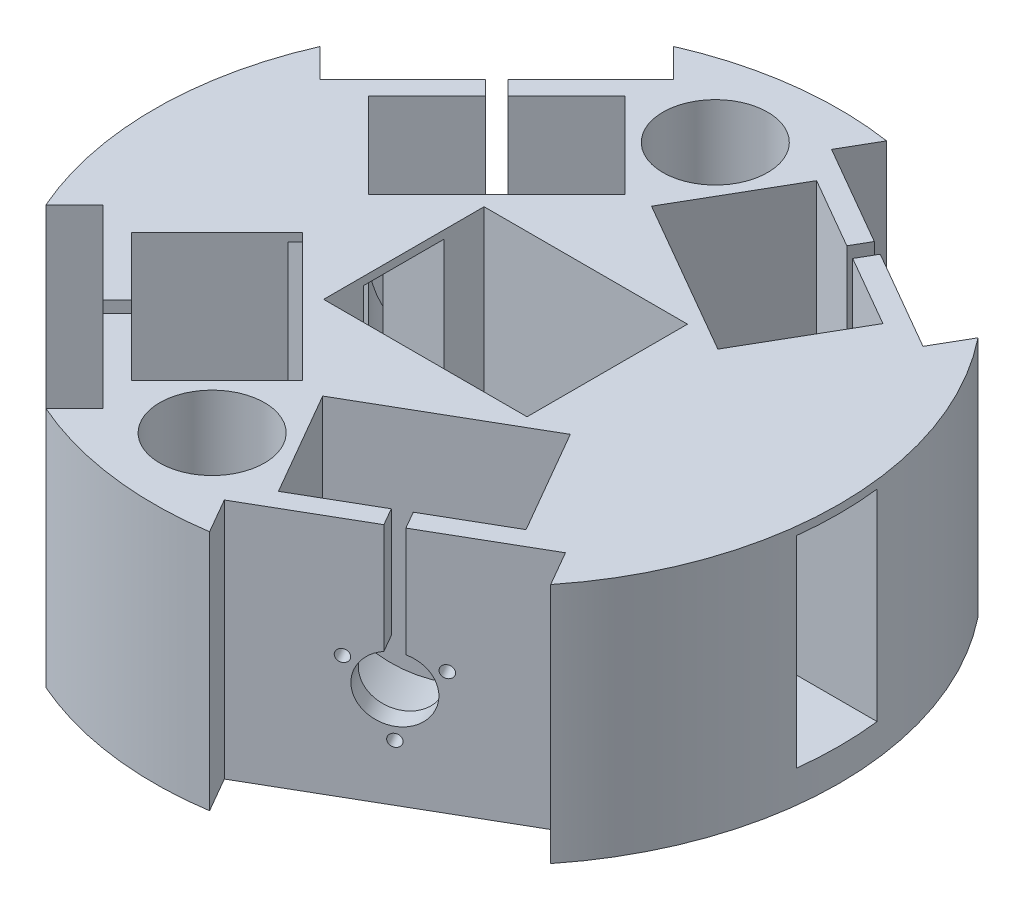
from build123d import *

# Parameters (mm, degrees)
BASE_DEPTH                 = 60
MOTOR_TRASEIRO_START       = -5
MOTOR_TRASEIRO_DEPTH       = 30
ESBO_O3_10_R               = 1.5
MOTOR_EIXO_DEPTH           = 25
PADR_OCIRCULAR1_COUNT      = 2
PADR_OCIRCULAR1_ANGLE      = 285
ESPELHAR3_START            = -5
ESPELHAR3_COPY_1_DEPTH     = 30
ESPELHAR3_COPY_2_SKETCH_R  = 1.5
ESPELHAR3_COPY_2_DEPTH     = 25
ESBO_O16_R                 = 13
CAPACITORES_DEPTH          = 45
CORTE_EXTRUS_O1_DEPTH      = 8
ESBO_O19_W                 = 50.5
ESBO_O19_H                 = 39.838709678
CORTE_EXTRUS_O2_DEPTH      = 131.973279718
CORTE_EXTRUS_O3_DEPTH      = 151.021417999
CORTE_EXTRUS_O3_DEPTH_BACK = 151.021417999
ESBO_O21_W                 = 20
ESBO_O21_H                 = 50
ESBO_O24_W                 = 20
ESBO_O24_H                 = 5
CORTE_EXTRUS_O6_DEPTH      = 158.318148985
ESBO_O25_R                 = 1.5
CORTE_EXTRUS_O7_DEPTH      = 10


with BuildPart() as part:
    # Esboço1 → Base (new body)
    with BuildSketch(Plane(origin=(0, 0, 0), x_dir=(1, 0, 0), z_dir=(0, 1, 0))):
        with BuildLine():
            Line((-70.813516723, -26.97289629), (-26.97289629, -70.813516723))
            Line((-26.97289629, -70.813516723), (-34.043964102, -77.884584535))
            ThreePointArc((-34.043964102, -77.884584535), (-11.094726339, -84.272813217), (12.725930358, -84.041957953))
            Line((12.725930358, -84.041957953), (7.725930358, -75.381703915))
            Line((7.725930358, -75.381703915), (61.419505392, -44.381703915))
            Line((61.419505392, -44.381703915), (66.419505392, -53.041957953))
            ThreePointArc((66.419505392, -53.041957953), (85, 0), (66.419505392, 53.041957953))
            Line((66.419505392, 53.041957953), (61.419505392, 44.381703915))
            Line((61.419505392, 44.381703915), (7.725930358, 75.381703915))
            Line((7.725930358, 75.381703915), (12.725930358, 84.041957953))
            ThreePointArc((12.725930358, 84.041957953), (-11.094726339, 84.272813217), (-34.043964102, 77.884584535))
            Line((-34.043964102, 77.884584535), (-26.97289629, 70.813516723))
            Line((-26.97289629, 70.813516723), (-70.813516723, 26.97289629))
            Line((-70.813516723, 26.97289629), (-77.884584535, 34.043964102))
            ThreePointArc((-77.884584535, 34.043964102), (-85, 0), (-77.884584535, -34.043964102))
            Line((-77.884584535, -34.043964102), (-70.813516723, -26.97289629))
        make_face()
    extrude(amount=BASE_DEPTH)

    # Esboço3 → Motor-traseiro (cut)
    with BuildSketch(Plane(origin=(-48.893206507, 0, 48.893206507), x_dir=(0.7071067811865515, 0, 0.7071067811865436), z_dir=(-0.7071067811865436, 0, 0.7071067811865515)).offset(MOTOR_TRASEIRO_START)):
        with BuildLine():
            ThreePointArc((-22.5, 25), (0, 2.5), (22.5, 25))
            Line((22.5, 25), (22.5, 80))
            Line((22.5, 80), (-22.5, 80))
            Line((-22.5, 80), (-22.5, 25))
        make_face()
    motor_traseiro = extrude(amount=-MOTOR_TRASEIRO_DEPTH, mode=Mode.SUBTRACT)

    # Esboço3<10> → Motor-eixo (cut)
    with BuildSketch(Plane(origin=(-48.893206507, 0, 48.893206507), x_dir=(0.7071067811865515, 0, 0.7071067811865436), z_dir=(-0.7071067811865436, 0, 0.7071067811865515))):
        with BuildLine():
            Line((2, 32.745966692), (2, 70))
            Line((2, 70), (-2, 70))
            Line((-2, 70), (-2, 32.745966692))
            ThreePointArc((-2, 32.745966692), (0, 17), (2, 32.745966692))
        make_face()
        with Locations((0, 14)):
            Circle(ESBO_O3_10_R)
        with Locations((-9.526279442, 30.5)):
            Circle(ESBO_O3_10_R)
        with Locations((9.526279442, 30.5)):
            Circle(ESBO_O3_10_R)
    motor_eixo = extrude(amount=-MOTOR_EIXO_DEPTH, mode=Mode.SUBTRACT)

    # PadrãoCircular1: Motor-traseiro, Motor-eixo ×2 about axis
    padr_ocircular1_axis = Axis((0, 60, 0), (0, -1, 0))
    add([motor_traseiro.rotate(padr_ocircular1_axis, i * PADR_OCIRCULAR1_ANGLE / (PADR_OCIRCULAR1_COUNT - 1)) for i in range(1, PADR_OCIRCULAR1_COUNT)], mode=Mode.SUBTRACT)
    add([motor_eixo.rotate(padr_ocircular1_axis, i * PADR_OCIRCULAR1_ANGLE / (PADR_OCIRCULAR1_COUNT - 1)) for i in range(1, PADR_OCIRCULAR1_COUNT)], mode=Mode.SUBTRACT)

    # Espelhar3: Motor-traseiro, Motor-eixo across plane
    add(motor_traseiro.mirror(Plane.XY), mode=Mode.SUBTRACT)
    add(motor_eixo.mirror(Plane.XY), mode=Mode.SUBTRACT)

    # Espelhar3 copy 1 sketch → Espelhar3 copy 1 (cut)
    with BuildSketch(Plane(origin=(34.572717875, 0, -59.881703915), x_dir=(0.8660254037844427, 0, 0.499999999999993), z_dir=(0.499999999999993, 0, -0.8660254037844427)).offset(ESPELHAR3_START)):
        with BuildLine():
            ThreePointArc((-22.5, -25), (0, -2.5), (22.5, -25))
            Line((22.5, -25), (22.5, -80))
            Line((22.5, -80), (-22.5, -80))
            Line((-22.5, -80), (-22.5, -25))
        make_face()
    extrude(amount=-ESPELHAR3_COPY_1_DEPTH, mode=Mode.SUBTRACT)

    # Espelhar3 copy 2 sketch → Espelhar3 copy 2 (cut)
    with BuildSketch(Plane(origin=(34.572717875, 0, -59.881703915), x_dir=(0.8660254037844427, 0, 0.499999999999993), z_dir=(0.499999999999993, 0, -0.8660254037844427))):
        with BuildLine():
            Line((2, -32.745966692), (2, -70))
            Line((2, -70), (-2, -70))
            Line((-2, -70), (-2, -32.745966692))
            ThreePointArc((-2, -32.745966692), (0, -17), (2, -32.745966692))
        make_face()
        with Locations((0, -14)):
            Circle(ESPELHAR3_COPY_2_SKETCH_R)
        with Locations((-9.526279442, -30.5)):
            Circle(ESPELHAR3_COPY_2_SKETCH_R)
        with Locations((9.526279442, -30.5)):
            Circle(ESPELHAR3_COPY_2_SKETCH_R)
    extrude(amount=-ESPELHAR3_COPY_2_DEPTH, mode=Mode.SUBTRACT)

    # Esboço16 → Capacitores (cut)
    with BuildSketch(Plane(origin=(0, 60, 0), x_dir=(1, 0, 0), z_dir=(0, 1, 0))):
        with Locations(Location((-8.22315011, -62.461026267, 0), (0, 0, 270))):
            Circle(ESBO_O16_R)
        with Locations(Location((-8.22315011, 62.461026267, 0), (0, 0, 270))):
            Circle(ESBO_O16_R)
    extrude(amount=-CAPACITORES_DEPTH, mode=Mode.SUBTRACT)

    # Esboço18 → Corte-extrusão1 (cut)
    with BuildSketch(Plane.XZ):
        Polygon((-33, -10), (-33, 10), (-8, 35), (0, 35), (40, 13), (40, -13), (0, -35), (-8, -35), align=None)
    extrude(amount=-CORTE_EXTRUS_O1_DEPTH, mode=Mode.SUBTRACT)

    # Esboço19 → Corte-extrusão2 (cut, through all)
    with BuildSketch(Plane.XZ.offset(-8)):
        with Locations((2.169354839, 0)):
            Rectangle(ESBO_O19_W, ESBO_O19_H)
    extrude(amount=-CORTE_EXTRUS_O2_DEPTH, mode=Mode.SUBTRACT)

    # Esboço21 → Corte-extrusão3 (cut, two sides: drawn at the far end of the back side and taken through both)
    with BuildSketch(Plane(origin=(-23.080645161, 0, 0), x_dir=(0, 0, -1), z_dir=(1, 0, 0)).offset(-CORTE_EXTRUS_O3_DEPTH_BACK)):
        with Locations((0, 33)):
            Rectangle(ESBO_O21_W, ESBO_O21_H)
    extrude(amount=CORTE_EXTRUS_O3_DEPTH + CORTE_EXTRUS_O3_DEPTH_BACK, mode=Mode.SUBTRACT)

    # Esboço24 → Corte-extrusão6 (cut, through all)
    with BuildSketch(Plane(origin=(-33, 0, 0), x_dir=(0, 0, -1), z_dir=(1, 0, 0))):
        with Locations((0, 5.5)):
            Rectangle(ESBO_O24_W, ESBO_O24_H)
    extrude(amount=-CORTE_EXTRUS_O6_DEPTH, mode=Mode.SUBTRACT)

    # Esboço25 → Corte-extrusão7 (cut)
    with BuildSketch(Plane.XZ.offset(-8)):
        with Locations(Location((-26.080645161, 13, 0), (0, 0, 270))):
            Circle(ESBO_O25_R)
        with Locations(Location((-10.080645161, 25.919354839, 0), (0, 0, 270))):
            Circle(ESBO_O25_R)
        with Locations(Location((5.419354839, 25.919354839, 0), (0, 0, 270))):
            Circle(ESBO_O25_R)
        with Locations(Location((30.419354839, 13, 0), (0, 0, 270))):
            Circle(ESBO_O25_R)
        with Locations(Location((30.419354839, -13, 0), (0, 0, 90))):
            Circle(ESBO_O25_R)
        with Locations(Location((5.419354839, -25.919354839, 0), (0, 0, 90))):
            Circle(ESBO_O25_R)
        with Locations(Location((-10.080645161, -25.919354839, 0), (0, 0, 90))):
            Circle(ESBO_O25_R)
        with Locations(Location((-26.080645161, -13, 0), (0, 0, 90))):
            Circle(ESBO_O25_R)
    extrude(amount=-CORTE_EXTRUS_O7_DEPTH, mode=Mode.SUBTRACT)


solid = part.part
